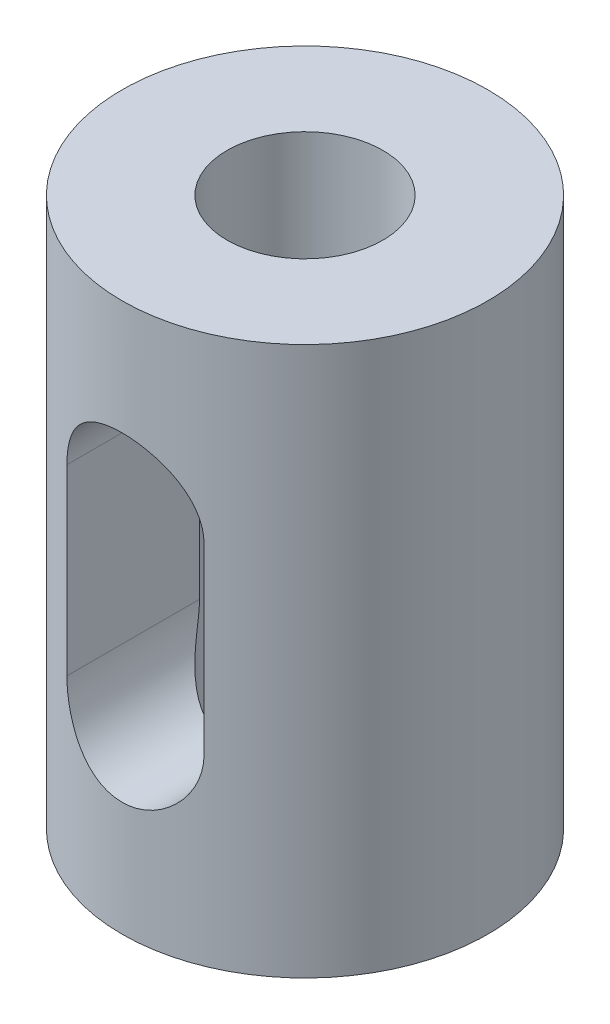
from build123d import *

# Parameters (mm, degrees)
SKETCH1_R                 = 3.175
BOSS_EXTRUDE1_DEPTH       = 9.525
TAP_DRILL_FOR_6_32_TAP1_D = 2.7051
CUT_EXTRUDE1_DEPTH        = 11.530283709
CUT_EXTRUDE1_DEPTH_BACK   = 11.530283709


with BuildPart() as part:
    # Sketch1 → Boss-Extrude1 (new body)
    with BuildSketch(Plane(origin=(0, 0, 0), x_dir=(1, 0, 0), z_dir=(0, 1, 0))):
        with Locations(Location((0, 0, 0), (0, 0, 90))):
            Circle(SKETCH1_R)
    extrude(amount=BOSS_EXTRUDE1_DEPTH)

    # Tap Drill for #6-32 Tap1 (through all)
    with Locations(Plane(origin=(0, 9.525, 0), x_dir=(1, 0, 0), z_dir=(0, 1, 0))):
        with Locations((0, 0)):
            Hole(TAP_DRILL_FOR_6_32_TAP1_D / 2)

    # Sketch4 → Cut-Extrude1 (cut, two sides: drawn at the far end of the back side and taken through both)
    with BuildSketch(Plane.XY.offset(-CUT_EXTRUDE1_DEPTH_BACK)):
        with BuildLine():
            Line((1.190625, 6.35), (1.190625, 3.175))
            ThreePointArc((1.190625, 3.175), (0, 1.984375), (-1.190625, 3.175))
            Line((-1.190625, 3.175), (-1.190625, 6.35))
            ThreePointArc((-1.190625, 6.35), (0, 7.540625), (1.190625, 6.35))
        make_face()
    extrude(amount=CUT_EXTRUDE1_DEPTH + CUT_EXTRUDE1_DEPTH_BACK, mode=Mode.SUBTRACT)


solid = part.part
